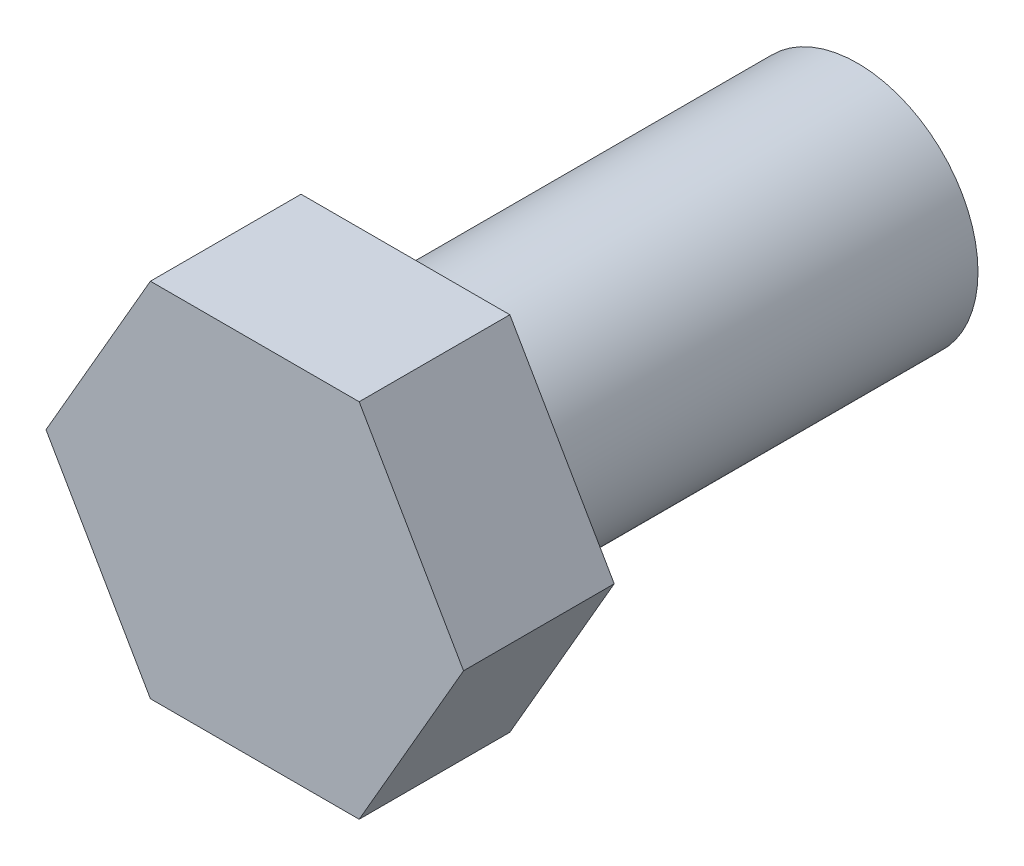
from build123d import *

# Parameters (mm, degrees)
SKETCH1_R      = 8
EXTRUDE1_DEPTH = 30
EXTRUDE2_DEPTH = 10


with BuildPart() as part:
    # Sketch1 → Extrude1 (new body)
    with BuildSketch(Plane.XY):
        Circle(SKETCH1_R)
    extrude(amount=-EXTRUDE1_DEPTH)

    # Sketch2 → Extrude2 (add)
    with BuildSketch(Plane.XY):
        Polygon((-6.92820323, 12), (-13.856406461, 0), (-6.92820323, -12), (6.92820323, -12), (13.856406461, 0), (6.92820323, 12), align=None)
    extrude(amount=EXTRUDE2_DEPTH)


solid = part.part
